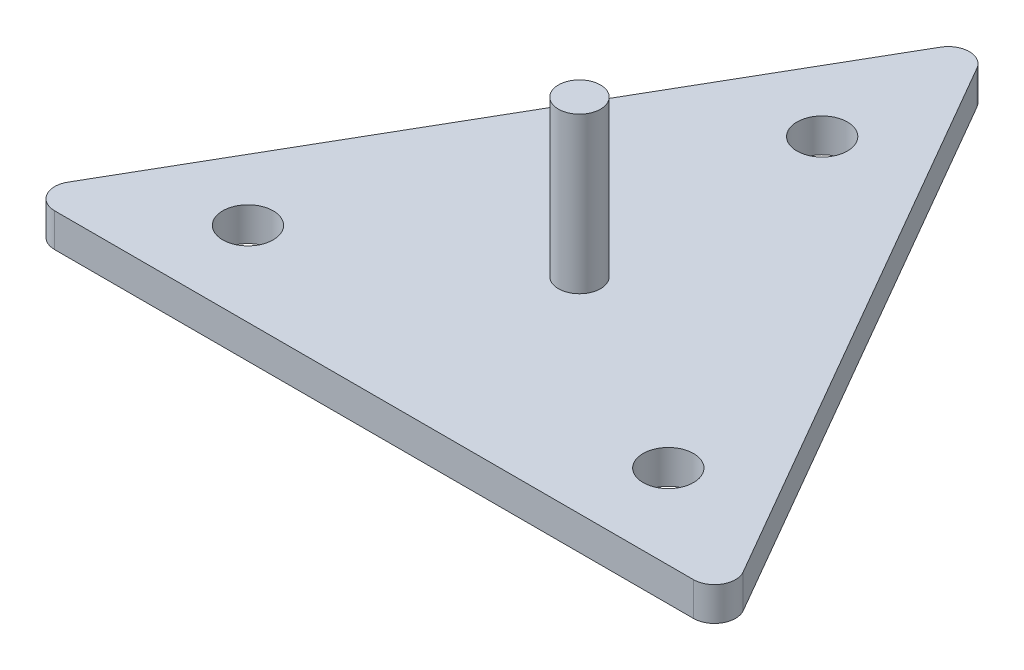
from build123d import *

# Parameters (mm, degrees)
BOSS_EXTRUDE1_DEPTH        = 8
F_12_0_12_DIAMETER_HOLE1_D = 12
SKETCH8_R                  = 5
BOSS_EXTRUDE2_DEPTH        = 45
FILLET1_R                  = 5


with BuildPart() as part:
    # Sketch1 → Boss-Extrude1 (new body)
    with BuildSketch(Plane(origin=(0, 0, 0), x_dir=(1, 0, 0), z_dir=(0, 1, 0))):
        Polygon((-65.68627451, 247.111542704), (18.954741642, 100.509002326), (-150.327290661, 100.509002326), align=None)
    extrude(amount=BOSS_EXTRUDE1_DEPTH)

    # Ø12.0 (12) Diameter Hole1 (through all)
    with Locations(Plane(origin=(0, 8, 0), x_dir=(1, 0, 0), z_dir=(0, 1, 0))):
        with Locations((-65.68627451, 207.111542704), (-115.68627451, 120.509002326), (-15.68627451, 120.509002326)):
            Hole(F_12_0_12_DIAMETER_HOLE1_D / 2)

    # Sketch8 → Boss-Extrude2 (add)
    with BuildSketch(Plane(origin=(0, 0, 0), x_dir=(-1, 0, 0), z_dir=(0, -1, 0))):
        with Locations(Location((65.68627451, 149.376515785, 0), (0, 0, 90))):
            Circle(SKETCH8_R)
    extrude(amount=-BOSS_EXTRUDE2_DEPTH)

    # Fillet1
    fillet1_edges = [part.edges().sort_by_distance(p)[0] for p in [
        (-150.327290661, 4, -100.509002326),
        (18.954741642, 4, -100.509002326),
        (-65.68627451, 4, -247.111542704),
    ]]
    fillet(fillet1_edges, radius=FILLET1_R)


solid = part.part
